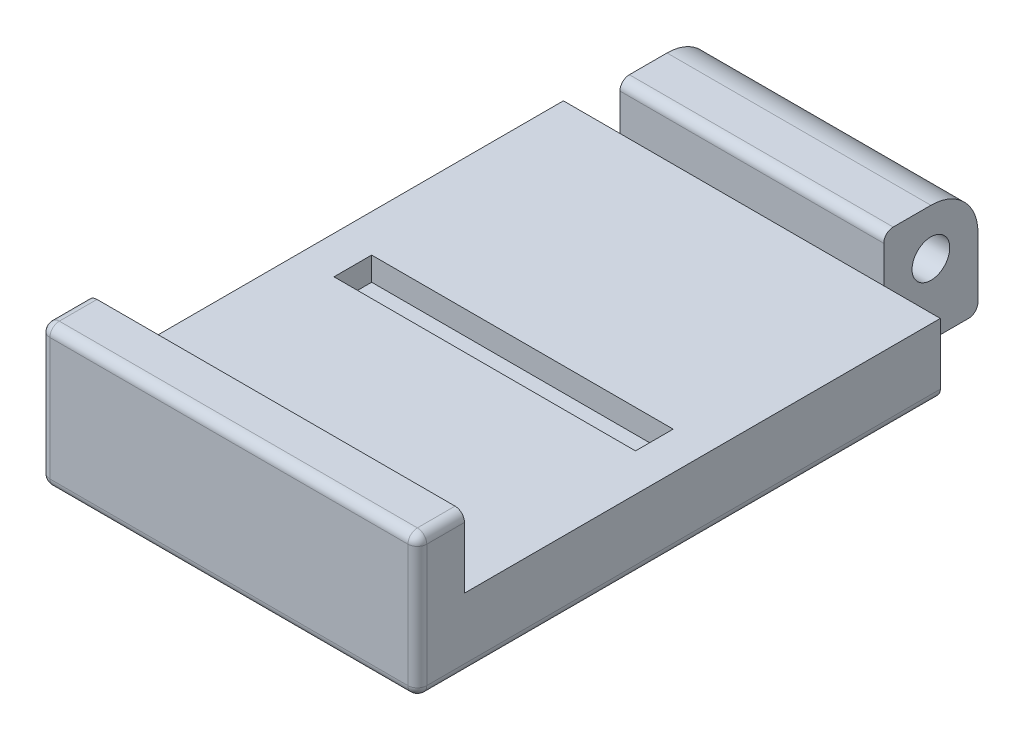
from build123d import *
from OCP.BRepFilletAPI import BRepFilletAPI_MakeFillet

# Parameters (mm, degrees)
CROQUIS2_W                 = 40
CROQUIS2_H                 = 15
SALIENTE_EXTRUIR1_DEPTH    = 65.5
REDONDEO1_R                = 1
CORTAR_EXTRUIR1_DEPTH      = 40
CORTAR_EXTRUIR4_DEPTH      = 1
CORTAR_EXTRUIR4_DEPTH_BACK = 10
CROQUIS9_W                 = 6
CROQUIS9_H                 = 15
CROQUIS10_W                = 6
CROQUIS10_H                = 15
CORTAR_EXTRUIR5_DEPTH      = 10
CROQUIS7_R                 = 2
CORTAR_EXTRUIR6_DEPTH      = 40
CROQUIS14_W                = 40.000001659
CROQUIS14_H                = 60.5
CORTAR_EXTRUIR9_DEPTH      = 2.6
REDONDEO5_R1               = 5
REDONDEO5_R2               = 1
CROQUIS16_W                = 32
CROQUIS16_H                = 4
CORTAR_EXTRUIR10_DEPTH     = 2.5


with BuildPart() as part:
    # Croquis2 → Saliente-Extruir1 (new body)
    with BuildSketch(Plane.XY):
        Rectangle(CROQUIS2_W, CROQUIS2_H)
    extrude(amount=SALIENTE_EXTRUIR1_DEPTH)

    # Redondeo1
    redondeo1_edges = [part.edges().sort_by_distance(p)[0] for p in [
        (20, 7.5, 32.75),
        (20, -7.5, 32.75),
        (0, -7.5, 65.5),
        (0, 7.5, 65.5),
        (20, 0, 65.5),
        (-20, 7.5, 32.75),
        (-20, 0, 65.5),
        (-20, -7.5, 32.75),
        (0, 7.5, 0),
        (-20, 0, 0),
        (0, -7.5, 0),
        (20, 0, 0),
    ]]
    fillet(redondeo1_edges, radius=REDONDEO1_R)

    # Croquis6 → Cortar-Extruir1 (cut)
    with BuildSketch(Plane(origin=(20, 0, 0), x_dir=(0, 0, -1), z_dir=(1, 0, 0))):
        Polygon((-60.5, 7.5), (-60.5, 0), (-55.501553512, 0), (-10, 0), (-10, 5), (-10, 7.5), align=None)
    extrude(amount=-CORTAR_EXTRUIR1_DEPTH, mode=Mode.SUBTRACT)

    # Croquis9 → Cortar-Extruir4 (cut, two sides: drawn at the far end of the back side and taken through both)
    with BuildSketch(Plane(origin=(0, 0, 0), x_dir=(-1, 0, 0), z_dir=(0, 0, -1)).offset(-CORTAR_EXTRUIR4_DEPTH_BACK)):
        with Locations((-17, 0)):
            Rectangle(CROQUIS9_W, CROQUIS9_H)
    extrude(amount=CORTAR_EXTRUIR4_DEPTH + CORTAR_EXTRUIR4_DEPTH_BACK, mode=Mode.SUBTRACT)

    # Croquis10 → Cortar-Extruir5 (cut)
    with BuildSketch(Plane(origin=(0, 0, 0), x_dir=(-1, 0, 0), z_dir=(0, 0, -1))):
        with Locations((17, 0)):
            Rectangle(CROQUIS10_W, CROQUIS10_H)
    extrude(amount=-CORTAR_EXTRUIR5_DEPTH, mode=Mode.SUBTRACT)

    # Croquis7 → Cortar-Extruir6 (cut)
    with BuildSketch(Plane(origin=(20, 0, 0), x_dir=(0, 0, -1), z_dir=(1, 0, 0))):
        with Locations((-5, 0)):
            Circle(CROQUIS7_R)
    extrude(amount=-CORTAR_EXTRUIR6_DEPTH, mode=Mode.SUBTRACT)

    # Croquis14 → Cortar-Extruir9 (cut)
    with BuildSketch(Plane(origin=(0, 7.5, 0), x_dir=(1, 0, 0), z_dir=(0, 1, 0))):
        with Locations((8.3e-07, -30.25)):
            Rectangle(CROQUIS14_W, CROQUIS14_H)
    extrude(amount=-CORTAR_EXTRUIR9_DEPTH, mode=Mode.SUBTRACT)

    # Redondeo5: one fillet with a radius per group of edges: ONE call of the kernel's fillet builder (fillet() takes one radius for all edges)
    redondeo5_edges_1 = [part.edges().sort_by_distance(p)[0] for p in [
        (0, 4.9, 0),
    ]]
    redondeo5_edges_2 = [part.edges().sort_by_distance(p)[0] for p in [
        (0, 4.9, 10),
    ]]
    redondeo5 = BRepFilletAPI_MakeFillet(part.part.solid().wrapped)
    for e in redondeo5_edges_1:
        redondeo5.Add(REDONDEO5_R1, e.wrapped)
    for e in redondeo5_edges_2:
        redondeo5.Add(REDONDEO5_R2, e.wrapped)
    add(Compound.cast(redondeo5.Shape()), mode=Mode.REPLACE)

    # Croquis16 → Cortar-Extruir10 (cut)
    with BuildSketch(Plane(origin=(0, 0, 0), x_dir=(1, 0, 0), z_dir=(0, 1, 0))):
        with Locations((0, -36.35)):
            Rectangle(CROQUIS16_W, CROQUIS16_H)
    extrude(amount=-CORTAR_EXTRUIR10_DEPTH, mode=Mode.SUBTRACT)


solid = part.part
